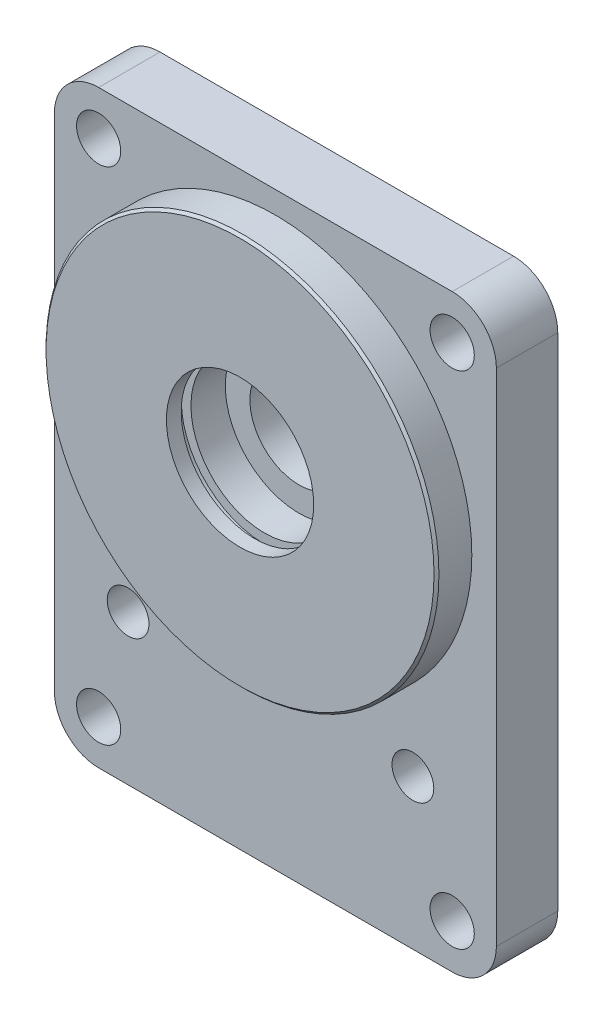
from build123d import *

# Parameters (mm, degrees)
IZIM1_R                      = 4.5
Y_KSEKLIK_EKSTR_ZYON1_DEPTH  = 6.25
IZIM2_R                      = 40
Y_KSEKLIK_EKSTR_ZYON2_DEPTH  = 7.2
IZIM3_R                      = 10
KES_EKSTR_ZYON1_DEPTH        = 19.7
IZIM5_R                      = 5.1
IZIM5_R_2                    = 10
Y_KSEKLIK_EKSTR_ZYON4_DEPTH  = 3
RADYUS1_R                    = 1
M10_DI_LI_DELIK1_D           = 8.5
M10_DI_LI_DELIK1_DEPTH       = 16.5
M10_DI_LI_DELIK1_CSINK_D     = 10.05
M10_DI_LI_DELIK1_CSINK_ANGLE = 90
M10_DI_LI_DELIK1_TIP         = 2.553657631
IZIM8_R                      = 8
KES_EKSTR_ZYON2_DEPTH        = 0.5
IZIM9_R                      = 15
KES_EKSTR_ZYON3_DEPTH        = 12
IZIM12_W                     = 2
IZIM12_H                     = 5
PAH1_SIZE                    = 0.5


with BuildPart() as part:
    # Çizim1 → Yükseklik-Ekstrüzyon1 (new, symmetric)
    with BuildSketch(Plane.XY):
        with BuildLine():
            Line((36, -60), (-36, -60))
            ThreePointArc((-36, -60), (-42.363961031, -57.363961031), (-45, -51))
            Line((-45, -51), (-45, 51))
            ThreePointArc((-45, 51), (-42.363961031, 57.363961031), (-36, 60))
            Line((-36, 60), (36, 60))
            ThreePointArc((36, 60), (42.363961031, 57.363961031), (45, 51))
            Line((45, 51), (45, -51))
            ThreePointArc((45, -51), (42.363961031, -57.363961031), (36, -60))
        make_face()
        with Locations((-36, 51)):
            Circle(IZIM1_R, mode=Mode.SUBTRACT)
        with Locations((36, 51)):
            Circle(IZIM1_R, mode=Mode.SUBTRACT)
        with Locations((36, -51)):
            Circle(IZIM1_R, mode=Mode.SUBTRACT)
        with Locations((-36, -51)):
            Circle(IZIM1_R, mode=Mode.SUBTRACT)
    extrude(amount=Y_KSEKLIK_EKSTR_ZYON1_DEPTH, both=True)

    # Çizim2 → Yükseklik-Ekstrüzyon2 (add)
    with BuildSketch(Plane.XY.offset(6.25)):
        with Locations((0, 15.5)):
            Circle(IZIM2_R)
    extrude(amount=Y_KSEKLIK_EKSTR_ZYON2_DEPTH)

    # Çizim3 → Kes-Ekstrüzyon1 (cut)
    with BuildSketch(Plane.XY.offset(13.45)):
        with Locations((0, 15.5)):
            Circle(IZIM3_R)
    extrude(amount=-KES_EKSTR_ZYON1_DEPTH, mode=Mode.SUBTRACT)

    # Çizim5 → Yükseklik-Ekstrüzyon4 (add)
    # profile 1 of 5: a face of its own
    with BuildSketch(Plane(origin=(0, 0, -6.25), x_dir=(-1, 0, 0), z_dir=(0, 0, -1))):
        with BuildLine():
            ThreePointArc((-27.67613629, -40.470020932), (0.598697028, -49.232491897), (28.873530346, -40.470020932))
            ThreePointArc((28.873530346, -40.470020932), (29.909704021, -39.925668254), (31.044039725, -39.637123229))
            ThreePointArc((31.044039725, -39.637123229), (37.872111368, -35.981672207), (40.598697028, -28.732491897))
            Line((40.598697028, -28.732491897), (40.598697028, -27.538464678))
            ThreePointArc((40.598697028, -27.538464678), (40.778918063, -26.825594786), (41.276275007, -26.28402376))
            Line((41.276275007, -26.28402376), (42.598697028, -25.417032756))
            Line((42.598697028, -25.417032756), (42.598697028, 26.952048961))
            Line((42.598697028, 26.952048961), (41.276275007, 27.819039965))
            ThreePointArc((41.276275007, 27.819039965), (40.778918063, 28.360610991), (40.598697028, 29.073480884))
            Line((40.598697028, 29.073480884), (40.598697028, 30.267508103))
            ThreePointArc((40.598697028, 30.267508103), (37.872111368, 37.516688413), (31.044039725, 41.172139435))
            ThreePointArc((31.044039725, 41.172139435), (29.909704021, 41.46068446), (28.873530346, 42.005037137))
            ThreePointArc((28.873530346, 42.005037137), (0.598697028, 50.767508103), (-27.67613629, 42.005037137))
            ThreePointArc((-27.67613629, 42.005037137), (-28.712309964, 41.46068446), (-29.846645668, 41.172139435))
            ThreePointArc((-29.846645668, 41.172139435), (-36.674717311, 37.516688413), (-39.401302972, 30.267508103))
            Line((-39.401302972, 30.267508103), (-39.401302972, 29.073480884))
            ThreePointArc((-39.401302972, 29.073480884), (-39.581524007, 28.360610991), (-40.078880951, 27.819039965))
            Line((-40.078880951, 27.819039965), (-41.401302972, 26.952048961))
            Line((-41.401302972, 26.952048961), (-41.401302972, -25.417032756))
            Line((-41.401302972, -25.417032756), (-40.078880951, -26.28402376))
            ThreePointArc((-40.078880951, -26.28402376), (-39.581524007, -26.825594786), (-39.401302972, -27.538464678))
            Line((-39.401302972, -27.538464678), (-39.401302972, -28.732491897))
            ThreePointArc((-39.401302972, -28.732491897), (-36.674717311, -35.981672207), (-29.846645668, -39.637123229))
            ThreePointArc((-29.846645668, -39.637123229), (-28.712309964, -39.925668254), (-27.67613629, -40.470020932))
        make_face()
        with Locations((-28.401302972, 30.267508103)):
            Circle(IZIM5_R, mode=Mode.SUBTRACT)
        with Locations((29.598697028, 30.267508103)):
            Circle(IZIM5_R, mode=Mode.SUBTRACT)
        with Locations((-28.401302972, -28.732491897)):
            Circle(IZIM5_R, mode=Mode.SUBTRACT)
        with Locations((29.598697028, -28.732491897)):
            Circle(IZIM5_R, mode=Mode.SUBTRACT)
        with Locations(Location((0, 15.5, 0), (0, 0, 180))):
            Circle(IZIM5_R_2, mode=Mode.SUBTRACT)
    # profile 2 of 5: a face of its own
    with BuildSketch(Plane(origin=(0, 0, -6.25), x_dir=(-1, 0, 0), z_dir=(0, 0, -1))):
        with Locations((-28.401302972, -28.732491897)):
            Circle(IZIM5_R)
    # profile 3 of 5: a face of its own
    with BuildSketch(Plane(origin=(0, 0, -6.25), x_dir=(-1, 0, 0), z_dir=(0, 0, -1))):
        with Locations((29.598697028, -28.732491897)):
            Circle(IZIM5_R)
    # profile 4 of 5: a face of its own
    with BuildSketch(Plane(origin=(0, 0, -6.25), x_dir=(-1, 0, 0), z_dir=(0, 0, -1))):
        with Locations((29.598697028, 30.267508103)):
            Circle(IZIM5_R)
    # profile 5 of 5: a face of its own
    with BuildSketch(Plane(origin=(0, 0, -6.25), x_dir=(-1, 0, 0), z_dir=(0, 0, -1))):
        with Locations((-28.401302972, 30.267508103)):
            Circle(IZIM5_R)
    extrude(amount=Y_KSEKLIK_EKSTR_ZYON4_DEPTH)

    # Radyus1
    radyus1_edges = [part.edges().sort_by_distance(p)[0] for p in [
        (-0.598697028, -49.232491897, -6.25),
        (-29.909704021, -39.925668254, -6.25),
        (-37.872111368, -35.981672207, -6.25),
        (-40.598697028, -28.135478288, -6.25),
        (-40.778918063, -26.825594786, -6.25),
        (-41.937486018, -25.850528258, -6.25),
        (28.712309964, 41.46068446, -6.25),
        (36.674717311, 37.516688413, -6.25),
        (39.401302972, 29.670494493, -6.25),
        (39.581524007, 28.360610991, -6.25),
        (40.740091961, 27.385544463, -6.25),
        (41.401302972, 0.767508103, -6.25),
        (28.712309964, -39.925668254, -6.25),
        (36.674717311, -35.981672207, -6.25),
        (39.401302972, -28.135478288, -6.25),
        (39.581524007, -26.825594786, -6.25),
        (40.740091961, -25.850528258, -6.25),
        (-0.598697028, 50.767508103, -6.25),
        (-29.909704021, 41.46068446, -6.25),
        (-37.872111368, 37.516688413, -6.25),
        (-40.598697028, 29.670494493, -6.25),
        (-40.778918063, 28.360610991, -6.25),
        (-41.937486018, 27.385544463, -6.25),
        (-42.598697028, 0.767508103, -6.25),
    ]]
    fillet(radyus1_edges, radius=RADYUS1_R)

    # M10 Dişli Delik1
    with Locations(Plane(origin=(0, 0, -9.25), x_dir=(-1, 0, 0), z_dir=(0, 0, -1))):
        with Locations((-28, 29.5), (30, 29.5), (30, -29.5), (-28, -29.5)):
            CounterSinkHole(M10_DI_LI_DELIK1_D / 2, M10_DI_LI_DELIK1_CSINK_D / 2, depth=M10_DI_LI_DELIK1_DEPTH, counter_sink_angle=M10_DI_LI_DELIK1_CSINK_ANGLE)
            with Locations((0, 0, -(M10_DI_LI_DELIK1_DEPTH + M10_DI_LI_DELIK1_TIP / 2))):  # 118° drill point
                Cone(0, M10_DI_LI_DELIK1_D / 2, M10_DI_LI_DELIK1_TIP, mode=Mode.SUBTRACT)

    # Çizim8 → Kes-Ekstrüzyon2 (cut)
    with BuildSketch(Plane(origin=(0, 0, -6.25), x_dir=(-1, 0, 0), z_dir=(0, 0, -1))):
        with Locations((-36, -51)):
            Circle(IZIM8_R)
        with Locations((36, -51)):
            Circle(IZIM8_R)
        with Locations((36, 51)):
            Circle(IZIM8_R)
        with Locations((-36, 51)):
            Circle(IZIM8_R)
    extrude(amount=-KES_EKSTR_ZYON2_DEPTH, mode=Mode.SUBTRACT)

    # Çizim9 → Kes-Ekstrüzyon3 (cut)
    with BuildSketch(Plane.XY.offset(13.45)):
        with Locations((0, 15.5)):
            Circle(IZIM9_R)
    extrude(amount=-KES_EKSTR_ZYON3_DEPTH, mode=Mode.SUBTRACT)

    # Çizim12 → Kes-Döndür1 (revolve, cut)
    with BuildSketch(Plane(origin=(0, 0, 0), x_dir=(0, 0, -1), z_dir=(1, 0, 0)), mode=Mode.PRIVATE) as kes_d_nd_r1_sk:
        with Locations((-9.45, 29.965908827)):
            Rectangle(IZIM12_W, IZIM12_H)
    revolve(kes_d_nd_r1_sk.sketch.rotate(Axis((0, 15.5, -23.6616227), (0, 0, 1)), 270), axis=Axis((0, 15.5, -23.6616227), (0, 0, 1)), mode=Mode.SUBTRACT)

    # Pah1
    pah1_edges = [part.edges().sort_by_distance(p)[0] for p in [
        (-40, 15.5, 13.45),
    ]]
    chamfer(pah1_edges, length=PAH1_SIZE)


solid = part.part
